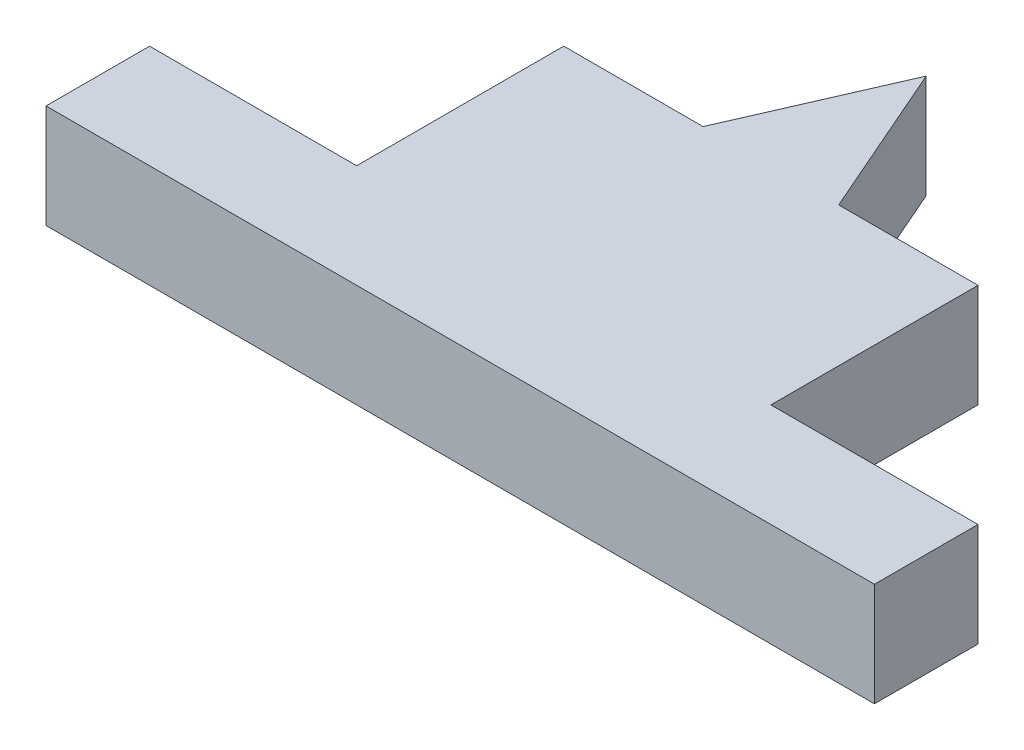
from build123d import *

# Parameters (mm, degrees)
BOSS_EXTRUDE1_DEPTH = 3.175


with BuildPart() as part:
    # Sketch1 → Boss-Extrude1 (new body)
    with BuildSketch(Plane(origin=(0, 0, 0), x_dir=(1, 0, 0), z_dir=(0, 1, 0))):
        Polygon((-12.7, 1.5875), (-6.35, 1.5875), (-6.35, 7.9375), (-2.079236033, 7.9375), (0, 12.7), (2.079236033, 7.9375), (6.35, 7.9375), (6.35, 1.5875), (12.7, 1.5875), (12.7, -1.5875), (-12.7, -1.5875), align=None)
    extrude(amount=BOSS_EXTRUDE1_DEPTH)


solid = part.part
